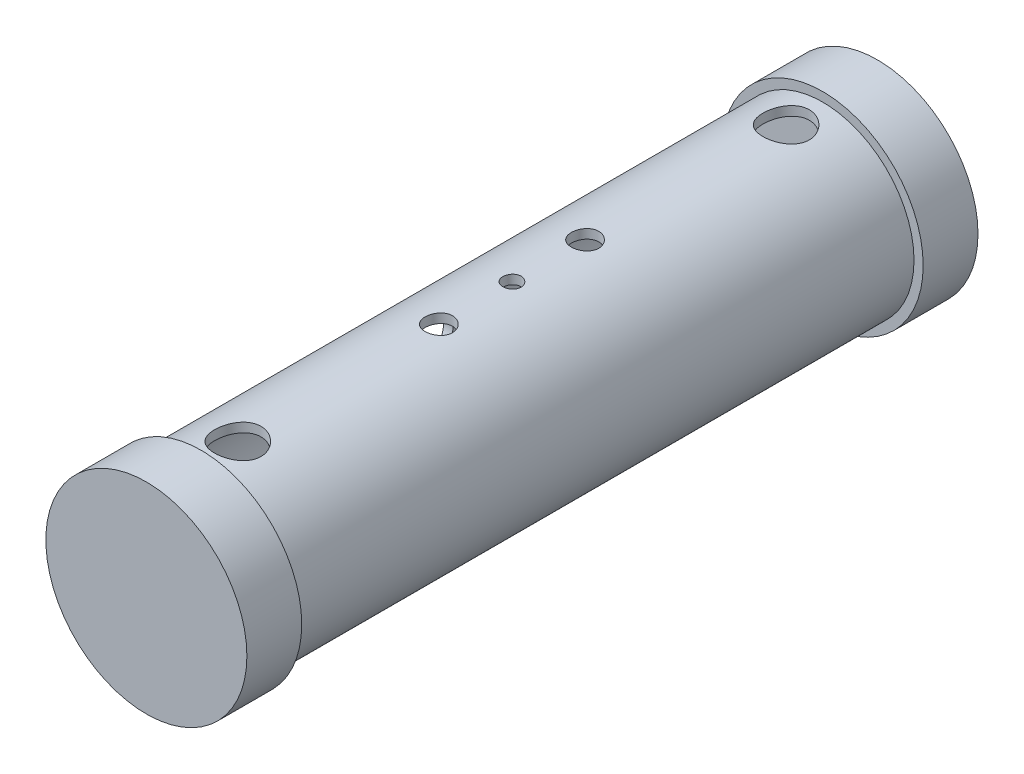
from build123d import *

# Parameters (mm, degrees)
CROQUIS1_R              = 50
CROQUIS1_R_2            = 45
SALIENTE_EXTRUIR1_DEPTH = 400
CROQUIS2_R              = 55
SALIENTE_EXTRUIR2_DEPTH = 30
SALIENTE_EXTRUIR3_START = -30
CROQUIS3_R              = 55
SALIENTE_EXTRUIR3_DEPTH = 30
CROQUIS4_R              = 12.75
CORTAR_EXTRUIR1_DEPTH   = 179
CROQUIS5_R              = 7.5
CROQUIS5_R_2            = 5
CROQUIS5_R_3            = 12.7
CORTAR_EXTRUIR2_DEPTH   = 60


with BuildPart() as part:
    # Croquis1 → Saliente-Extruir1 (new body)
    with BuildSketch(Plane.XY):
        Circle(CROQUIS1_R)
        Circle(CROQUIS1_R_2, mode=Mode.SUBTRACT)
    extrude(amount=SALIENTE_EXTRUIR1_DEPTH)

    # Croquis2 → Saliente-Extruir2 (add)
    with BuildSketch(Plane.XY):
        Circle(CROQUIS2_R)
    extrude(amount=SALIENTE_EXTRUIR2_DEPTH)

    # Croquis3 → Saliente-Extruir3 (add)
    with BuildSketch(Plane.XY.offset(400).offset(SALIENTE_EXTRUIR3_START)):
        Circle(CROQUIS3_R)
    extrude(amount=SALIENTE_EXTRUIR3_DEPTH)

    # Croquis4 → Cortar-Extruir1 (cut)
    with BuildSketch(Plane(origin=(0, 0, 0), x_dir=(0, 0, -1), z_dir=(1, 0, 0))):
        with Locations(Location((-200, 0, 0), (0, 0, 180))):
            Circle(CROQUIS4_R)
    extrude(amount=-CORTAR_EXTRUIR1_DEPTH, mode=Mode.SUBTRACT)

    # Croquis5 → Cortar-Extruir2 (cut)
    with BuildSketch(Plane(origin=(0, 50, 0), x_dir=(1, 0, 0), z_dir=(0, 1, 0))):
        with Locations(Location((0, -240, 0), (0, 0, 270))):
            Circle(CROQUIS5_R)
        with Locations(Location((0, -160, 0), (0, 0, 270))):
            Circle(CROQUIS5_R)
        with Locations(Location((0, -200, 0), (0, 0, 270))):
            Circle(CROQUIS5_R_2)
        with Locations(Location((0, -350, 0), (0, 0, 270))):
            Circle(CROQUIS5_R_3)
        with Locations(Location((0, -50, 0), (0, 0, 270))):
            Circle(CROQUIS5_R_3)
    extrude(amount=-CORTAR_EXTRUIR2_DEPTH, mode=Mode.SUBTRACT)


solid = part.part
